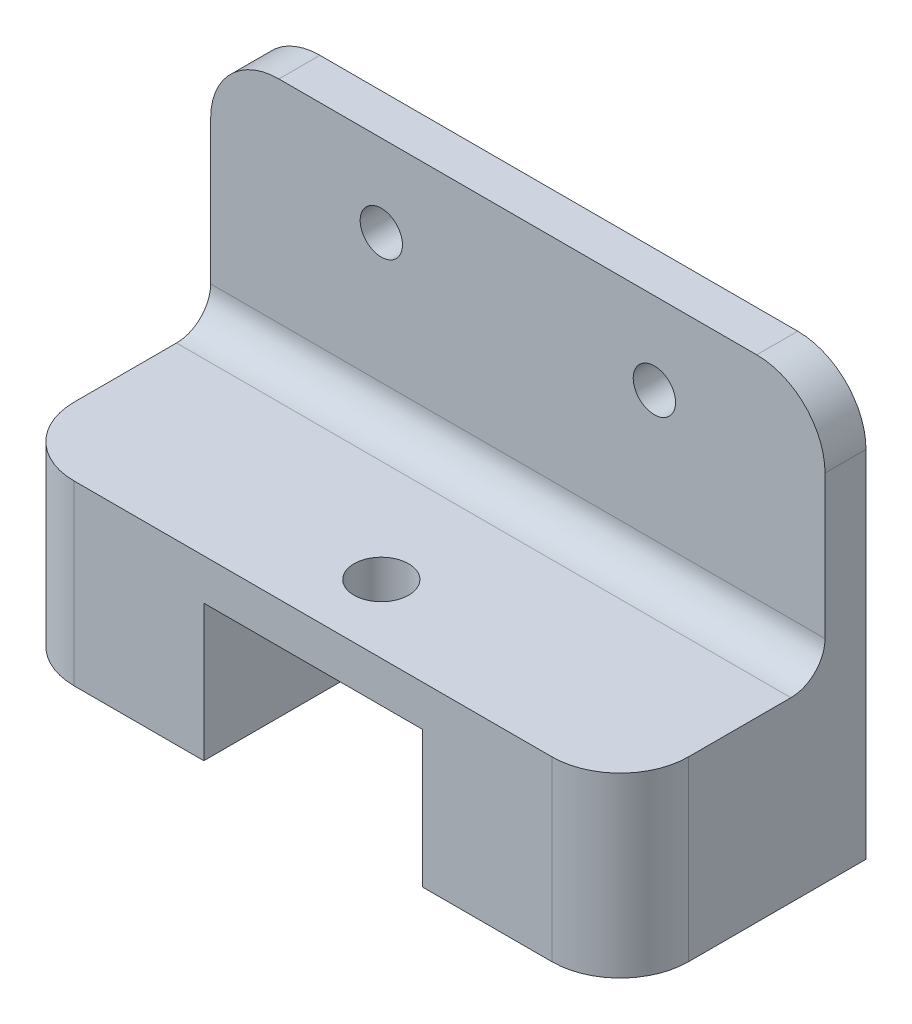
from build123d import *

# Parameters (mm, degrees)
SALIENTE_EXTRUIR1_DEPTH = 45
REDONDEO1_R             = 2.5
CROQUIS2_R              = 2
CORTAR_EXTRUIR1_DEPTH   = 50.295030175
CROQUIS3_R              = 1.55
CORTAR_EXTRUIR2_DEPTH   = 53.242224302
CROQUIS4_W              = 45
CROQUIS4_H              = 18
SALIENTE_EXTRUIR2_DEPTH = 10
REDONDEO3_R             = 5
CROQUIS5_W              = 16
CROQUIS5_H              = 10
CORTAR_EXTRUIR3_DEPTH   = 53.242224302
REDONDEO4_R             = 5


with BuildPart() as part:
    # Croquis1 → Saliente-Extruir1 (new body)
    with BuildSketch(Plane(origin=(0, 0, 0), x_dir=(0, 0, -1), z_dir=(1, 0, 0))):
        Polygon((-9, -1.5), (9, -1.5), (9, 1.5), (9, 19.5), (6, 19.5), (6, 1.5), (-9, 1.5), align=None)
    extrude(amount=SALIENTE_EXTRUIR1_DEPTH)

    # Redondeo1
    redondeo1_edges = [part.edges().sort_by_distance(p)[0] for p in [
        (22.5, 1.5, -6),
    ]]
    fillet(redondeo1_edges, radius=REDONDEO1_R)

    # Croquis2 → Cortar-Extruir1 (cut, through all)
    with BuildSketch(Plane(origin=(0, 1.5, 0), x_dir=(1, 0, 0), z_dir=(0, 1, 0))):
        with Locations(Location((22.5, -4, 0), (0, 0, 270))):
            Circle(CROQUIS2_R)
    extrude(amount=-CORTAR_EXTRUIR1_DEPTH, mode=Mode.SUBTRACT)

    # Croquis3 → Cortar-Extruir2 (cut, through all)
    with BuildSketch(Plane(origin=(0, 0, -9), x_dir=(-1, 0, 0), z_dir=(0, 0, -1))):
        with Locations(Location((-32.5, 13.5, 0), (0, 0, 90))):
            Circle(CROQUIS3_R)
        with Locations((-12.5, 13.5)):
            Circle(CROQUIS3_R)
    extrude(amount=-CORTAR_EXTRUIR2_DEPTH, mode=Mode.SUBTRACT)

    # Croquis4 → Saliente-Extruir2 (add)
    with BuildSketch(Plane.XZ.offset(1.5)):
        with Locations((22.5, 0)):
            Rectangle(CROQUIS4_W, CROQUIS4_H)
    extrude(amount=SALIENTE_EXTRUIR2_DEPTH)

    # Redondeo3
    redondeo3_edges = [part.edges().sort_by_distance(p)[0] for p in [
        (45, -5, 9),
        (0, -5, 9),
    ]]
    fillet(redondeo3_edges, radius=REDONDEO3_R)

    # Croquis5 → Cortar-Extruir3 (cut, through all)
    with BuildSketch(Plane.XY.offset(9)):
        with Locations((22.5, -6.5)):
            Rectangle(CROQUIS5_W, CROQUIS5_H)
    extrude(amount=-CORTAR_EXTRUIR3_DEPTH, mode=Mode.SUBTRACT)

    # Redondeo4
    redondeo4_edges = [part.edges().sort_by_distance(p)[0] for p in [
        (45, 19.5, -7.5),
        (0, 19.5, -7.5),
    ]]
    fillet(redondeo4_edges, radius=REDONDEO4_R)


solid = part.part
